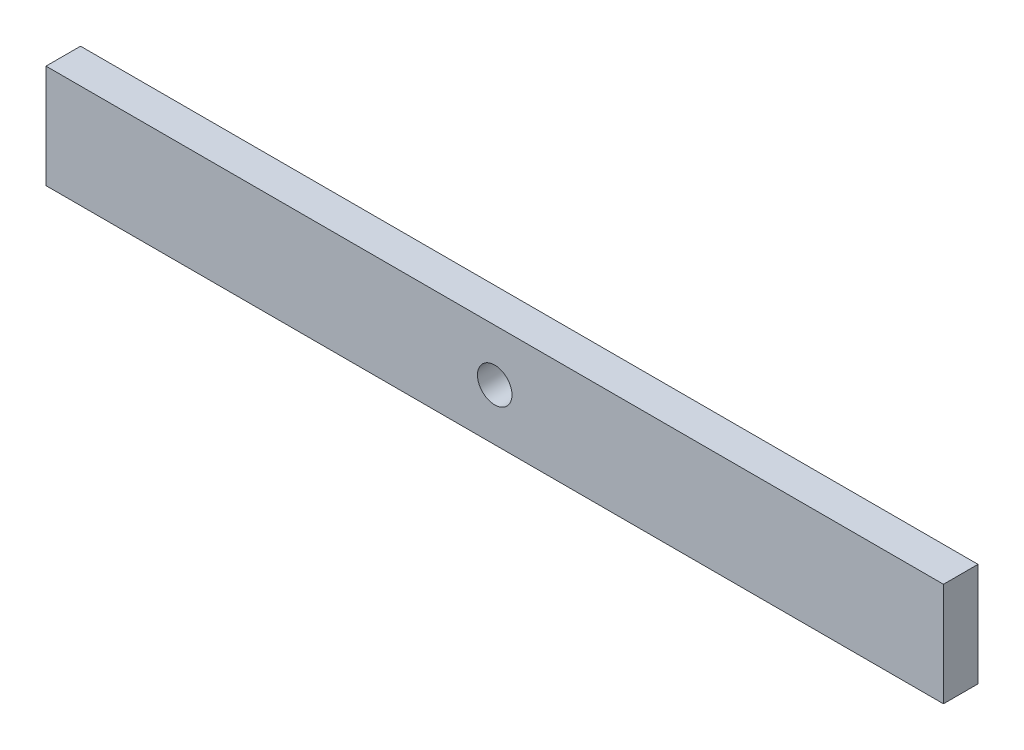
from build123d import *

# Parameters (mm, degrees)
ESQUISSE1_W             = 260
ESQUISSE1_H             = 30
BOSS_EXTRU_1_DEPTH      = 10
ESQUISSE2_R             = 5
ENL_V_MAT_EXTRU_1_DEPTH = 10


with BuildPart() as part:
    # Esquisse1 → Boss.-Extru.1 (new body)
    with BuildSketch(Plane.XY):
        Rectangle(ESQUISSE1_W, ESQUISSE1_H)
    extrude(amount=BOSS_EXTRU_1_DEPTH)

    # Esquisse2 → Enlèv. mat.-Extru.1 (cut)
    with BuildSketch(Plane.XY.offset(10)):
        Circle(ESQUISSE2_R)
    extrude(amount=-ENL_V_MAT_EXTRU_1_DEPTH, mode=Mode.SUBTRACT)


solid = part.part
